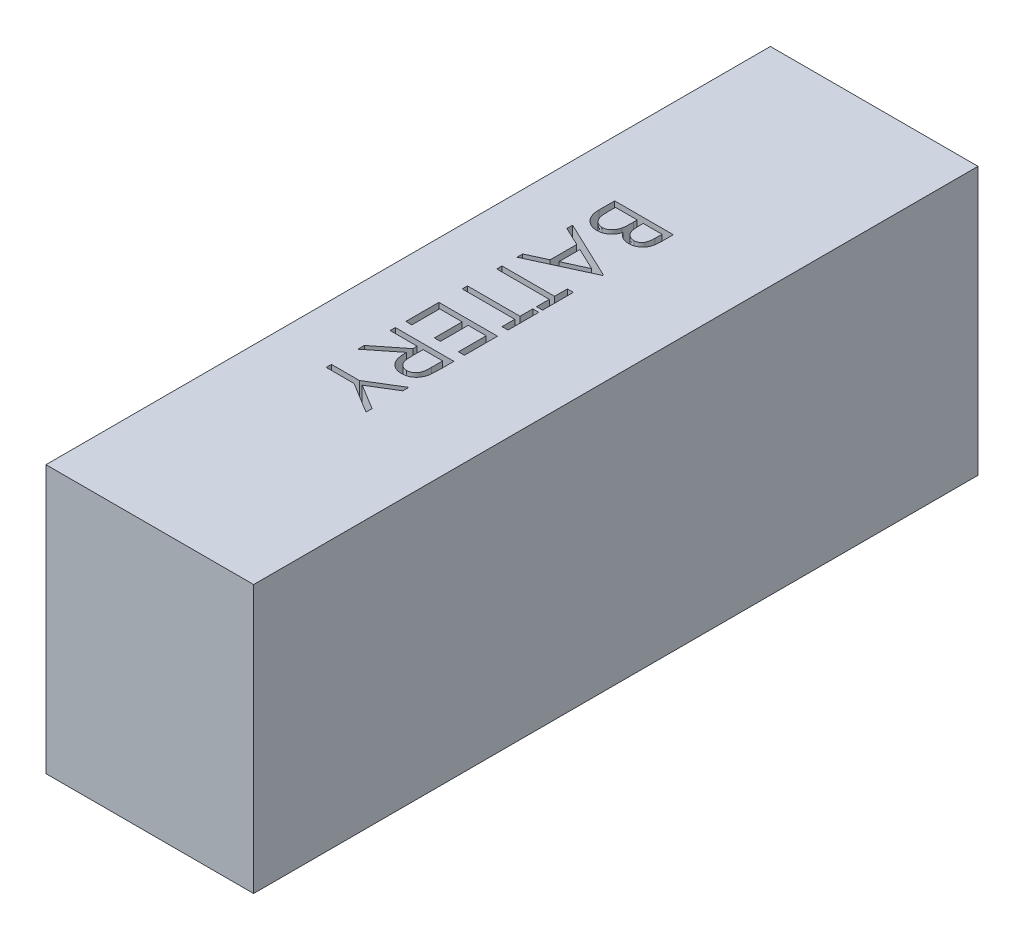
from build123d import *

# Parameters (mm, degrees)
SKETCH1_W           = 45
SKETCH1_H           = 58
BOSS_EXTRUDE1_DEPTH = 157
CUT_EXTRUDE1_DEPTH  = 10


with BuildPart() as part:
    # Sketch1 → Boss-Extrude1 (new body)
    with BuildSketch(Plane.XY):
        with Locations((22.5, 29)):
            Rectangle(SKETCH1_W, SKETCH1_H)
    extrude(amount=-BOSS_EXTRUDE1_DEPTH)

    # Sketch2 → Cut-Extrude1 (cut)
    # profile 1 of 7: a face of its own
    with BuildSketch(Plane(origin=(0, 58, 0), x_dir=(1, 0, 0), z_dir=(0, 1, 0))):
        with BuildLine():
            Line((24.809530829, 111.145512821), (24.809530829, 108.667588141))
            add(Edge.make_bspline(
                [(24.809530829, 108.667588141), (24.808893106, 108.54629052), (24.807657041, 108.311185543), (24.788486822, 107.969303568), (24.762347791, 107.649086455), (24.720872884, 107.350441338), (24.670828435, 107.073506218), (24.610224702, 106.817446506), (24.537556704, 106.583076452), (24.422000198, 106.30326738), (24.250284701, 105.984240982), (23.996543908, 105.638806814), (23.686183256, 105.343425717), (23.336089049, 105.088749652), (22.95096782, 104.886271304), (22.539998764, 104.739788425), (22.108482729, 104.647049848), (21.812234626, 104.637512387), (21.662515605, 104.632692308)],
                knots=[0, 0, 0, 0, 1.001505555, 1.941167018, 2.826882275, 3.653841531, 4.429895133, 5.150066043, 5.825578002, 6.45369114, 7.647487171, 8.808567382, 9.977351308, 11.170798116, 12.373658725, 13.556498008, 14.765093433, 16, 16, 16, 16], degree=3))
            add(Edge.make_bspline(
                [(21.662515605, 104.632692308), (21.522238282, 104.636582462), (21.246580113, 104.644226982), (20.844049009, 104.71981612), (20.459295066, 104.832357565), (20.097061504, 104.99573449), (19.76200381, 105.205887774), (19.456113217, 105.458782995), (19.186802729, 105.759887816), (19.036871162, 105.985844988), (18.96071272, 106.100620994)],
                knots=[0, 0, 0, 0, 1.044266239, 2.052081639, 3.041743201, 4.026043445, 5.00270663, 5.980942822, 6.97441044, 8, 8, 8, 8], degree=3))
            add(Edge.make_bspline(
                [(18.96071272, 106.100620994), (18.905365325, 105.95632328), (18.799472049, 105.680246008), (18.611235299, 105.300054037), (18.408807209, 104.971179544), (18.186575557, 104.693260537), (17.944037947, 104.459156781), (17.686051059, 104.24892675), (17.399913839, 104.072801118), (17.093773846, 103.921494355), (16.76977972, 103.802417518), (16.429413214, 103.718162843), (16.076480239, 103.666392446), (15.835920554, 103.659333035), (15.714478746, 103.655769231)],
                knots=[0, 0, 0, 0, 1.272302504, 2.434229863, 3.488457646, 4.447234501, 5.35599188, 6.26022912, 7.18267843, 8.11661068, 9.06895546, 10.019249207, 11.000057067, 12, 12, 12, 12], degree=3))
            add(Edge.make_bspline(
                [(15.714478746, 103.655769231), (15.590502513, 103.659314899), (15.346575801, 103.6662911), (14.988225701, 103.717728252), (14.645816367, 103.804905405), (14.316913221, 103.924691577), (14.003377969, 104.081915883), (13.701283845, 104.269129061), (13.418678433, 104.496991224), (13.148841064, 104.75097586), (12.906367685, 105.038640782), (12.690499049, 105.348963686), (12.512154803, 105.686408036), (12.364213893, 106.045740962), (12.249560444, 106.429350245), (12.169962703, 106.835813552), (12.116204764, 107.265219212), (12.111793222, 107.559896716), (12.109530829, 107.711017628)],
                knots=[0, 0, 0, 0, 0.978404568, 1.925038397, 2.85041836, 3.763147166, 4.682162379, 5.614488577, 6.562659439, 7.54271123, 8.535210642, 9.526693784, 10.520907202, 11.541451354, 12.589717429, 13.675358278, 14.807842563, 16, 16, 16, 16], degree=3))
            Line((12.109530829, 107.711017628), (12.109530829, 111.145512821))
            Line((12.109530829, 111.145512821), (24.809530829, 111.145512821))
        make_face()
        with BuildLine():
            Line((23.506966727, 110.005769231), (19.436453906, 110.005769231))
            Line((19.436453906, 110.005769231), (19.436453906, 109.240004006))
            add(Edge.make_bspline(
                [(19.436453906, 109.240004006), (19.437892979, 109.128065941), (19.440673562, 108.911778787), (19.448889658, 108.597728502), (19.470887646, 108.306944517), (19.494154147, 108.038424842), (19.529979798, 107.793969213), (19.57382033, 107.57275926), (19.619780365, 107.372807823), (19.698161874, 107.14232471), (19.812827018, 106.880959914), (19.994962363, 106.604106035), (20.206005833, 106.356074076), (20.454013483, 106.148970517), (20.724782893, 105.97807388), (21.018338202, 105.864024881), (21.323219108, 105.783131424), (21.533071985, 105.776037594), (21.63961897, 105.772435897)],
                knots=[0, 0, 0, 0, 1.156481963, 2.23455883, 3.244418989, 4.168404366, 5.01828131, 5.794834307, 6.498111525, 7.13526334, 8.307595709, 9.435046769, 10.546766856, 11.659452936, 12.760769924, 13.837671619, 14.902137667, 16, 16, 16, 16], degree=3))
            add(Edge.make_bspline(
                [(21.63961897, 105.772435897), (21.710139968, 105.774237257), (21.848474607, 105.777770821), (22.049357882, 105.809930451), (22.240706288, 105.856594388), (22.418118944, 105.929497694), (22.586638424, 106.017652859), (22.738779651, 106.132326731), (22.882877828, 106.261832414), (23.013642027, 106.413924233), (23.130807261, 106.58786575), (23.23390239, 106.785314309), (23.315226777, 107.008627547), (23.38817908, 107.252742089), (23.438800029, 107.521564771), (23.481125883, 107.812468828), (23.502641286, 108.127922089), (23.505492754, 108.346162254), (23.506966727, 108.458974359)],
                knots=[0, 0, 0, 0, 0.911752476, 1.788502045, 2.626783689, 3.45400582, 4.26402138, 5.080402872, 5.911472738, 6.767166405, 7.66795952, 8.620018292, 9.640966946, 10.73819047, 11.913090943, 13.176185384, 14.540321519, 16, 16, 16, 16], degree=3))
            Line((23.506966727, 108.458974359), (23.506966727, 110.005769231))
        make_face(mode=Mode.SUBTRACT)
        with BuildLine():
            Line((18.133889803, 110.005769231), (13.412094932, 110.005769231))
            Line((13.412094932, 110.005769231), (13.412094932, 108.382652244))
            add(Edge.make_bspline(
                [(13.412094932, 108.382652244), (13.413482523, 108.266468708), (13.416156923, 108.042540259), (13.424983038, 107.719237749), (13.444637484, 107.420394528), (13.476679472, 107.145838632), (13.509973891, 106.893153221), (13.556054976, 106.664848731), (13.608443598, 106.460575153), (13.689517472, 106.223744861), (13.815252181, 105.956887506), (14.006068063, 105.669509001), (14.230402386, 105.411454901), (14.493313949, 105.194831409), (14.777020994, 105.015952223), (15.080039637, 104.890493813), (15.393125684, 104.809825853), (15.60714542, 104.800293436), (15.714478746, 104.795512821)],
                knots=[0, 0, 0, 0, 1.159821618, 2.235403267, 3.228114831, 4.14795534, 4.994323282, 5.771256229, 6.471395042, 7.097801288, 8.267864287, 9.404187171, 10.531774336, 11.667624178, 12.792825787, 13.866573821, 14.930062559, 16, 16, 16, 16], degree=3))
            add(Edge.make_bspline(
                [(15.714478746, 104.795512821), (15.781591834, 104.796489963), (15.914735472, 104.798428488), (16.110246303, 104.828763131), (16.300476302, 104.871081938), (16.482548915, 104.932363208), (16.659426851, 105.009633923), (16.828029175, 105.106605738), (16.99238723, 105.218589814), (17.199934206, 105.39376991), (17.439144968, 105.648331942), (17.673315153, 106.010145839), (17.86217681, 106.421519463), (17.942365987, 106.719888629), (17.983789643, 106.874018429)],
                knots=[0, 0, 0, 0, 0.723503378, 1.435336582, 2.130201219, 2.824764462, 3.504949994, 4.209866579, 4.920640069, 5.648298893, 7.13757748, 8.670694625, 10.280166878, 12, 12, 12, 12], degree=3))
            add(Edge.make_bspline(
                [(17.983789643, 106.874018429), (17.996327505, 106.935809662), (18.023512175, 107.069785801), (18.052189636, 107.288254417), (18.077914253, 107.538503756), (18.096443163, 107.819464208), (18.116333625, 108.132253189), (18.123793762, 108.476770213), (18.132899252, 108.853258839), (18.133551173, 109.114488624), (18.133889803, 109.250180288)],
                knots=[0, 0, 0, 0, 0.634452549, 1.375623993, 2.216454381, 3.166361212, 4.209414599, 5.370755378, 6.634280627, 8, 8, 8, 8], degree=3))
            Line((18.133889803, 109.250180288), (18.133889803, 110.005769231))
        make_face(mode=Mode.SUBTRACT)
    # profile 2 of 7: a face of its own
    with BuildSketch(Plane(origin=(0, 58, 0), x_dir=(1, 0, 0), z_dir=(0, 1, 0))):
        Polygon((24.809530829, 95.840384615), (12.109530829, 89.978846154), (12.109530829, 91.217808494), (16.18004365, 93.095332532), (16.18004365, 98.852564103), (12.109530829, 100.783513622), (12.109530829, 102.027564103), (24.809530829, 96.003205128), align=None)
        Polygon((22.33415022, 95.934515224), (17.482607752, 98.234354968), (17.482607752, 93.695733173), align=None, mode=Mode.SUBTRACT)
    # profile 3 of 7: a face of its own
    with BuildSketch(Plane(origin=(0, 58, 0), x_dir=(1, 0, 0), z_dir=(0, 1, 0))):
        Polygon((23.506966727, 89.490384615), (24.809530829, 89.490384615), (24.809530829, 82.81474359), (23.506966727, 82.81474359), (23.506966727, 85.582692308), (12.109530829, 85.582692308), (12.109530829, 86.722435897), (23.506966727, 86.722435897), align=None)
    # profile 4 of 7: a face of its own
    with BuildSketch(Plane(origin=(0, 58, 0), x_dir=(1, 0, 0), z_dir=(0, 1, 0))):
        Polygon((23.506966727, 82.000641026), (24.809530829, 82.000641026), (24.809530829, 75.325), (23.506966727, 75.325), (23.506966727, 78.092948718), (12.109530829, 78.092948718), (12.109530829, 79.232692308), (23.506966727, 79.232692308), align=None)
    # profile 5 of 7: a face of its own
    with BuildSketch(Plane(origin=(0, 58, 0), x_dir=(1, 0, 0), z_dir=(0, 1, 0))):
        Polygon((24.809530829, 73.045512821), (24.809530829, 65.881410256), (23.506966727, 65.881410256), (23.506966727, 71.905769231), (19.599274419, 71.905769231), (19.599274419, 65.881410256), (18.296710316, 65.881410256), (18.296710316, 71.905769231), (13.412094932, 71.905769231), (13.412094932, 65.881410256), (12.109530829, 65.881410256), (12.109530829, 73.045512821), align=None)
    # profile 6 of 7: a face of its own
    with BuildSketch(Plane(origin=(0, 58, 0), x_dir=(1, 0, 0), z_dir=(0, 1, 0))):
        with BuildLine():
            Line((24.809530829, 63.601923077), (24.809530829, 61.060396635))
            add(Edge.make_bspline(
                [(24.809530829, 61.060396635), (24.808966274, 60.890793111), (24.807882266, 60.565135559), (24.801837927, 60.098598263), (24.784513836, 59.674682797), (24.769605547, 59.293610809), (24.742420503, 58.955389289), (24.716437584, 58.65898112), (24.682424586, 58.405751475), (24.650836337, 58.252459386), (24.636534034, 58.183052885)],
                knots=[0, 0, 0, 0, 1.410062039, 2.707475311, 3.878576406, 4.937260626, 5.877586885, 6.699081471, 7.410979367, 8, 8, 8, 8], degree=3))
            add(Edge.make_bspline(
                [(24.636534034, 58.183052885), (24.613579519, 58.090135783), (24.568160169, 57.906283755), (24.472111835, 57.641602973), (24.361145734, 57.389277684), (24.229800309, 57.150254792), (24.080366507, 56.924512121), (23.91197124, 56.712387672), (23.723756935, 56.515094219), (23.520529794, 56.331113686), (23.300516599, 56.164341253), (23.066922345, 56.020021533), (22.821208028, 55.896441282), (22.56251798, 55.79778345), (22.293038999, 55.71841625), (22.010418028, 55.662435913), (21.715918501, 55.628868735), (21.515048531, 55.625450949), (21.413196694, 55.623717949)],
                knots=[0, 0, 0, 0, 1.02737288, 2.032829108, 3.019628684, 3.985738875, 4.958353778, 5.924249254, 6.890702889, 7.883913451, 8.865824512, 9.85161466, 10.829249435, 11.81541824, 12.821369441, 13.843154991, 14.906364023, 16, 16, 16, 16], degree=3))
            add(Edge.make_bspline(
                [(21.413196694, 55.623717949), (21.243977692, 55.629048175), (20.913787588, 55.639448827), (20.434597967, 55.736424707), (19.987586793, 55.895263869), (19.573376151, 56.114177265), (19.199821907, 56.392825875), (18.872826763, 56.72769814), (18.596664465, 57.117083891), (18.407192789, 57.481278361), (18.285278592, 57.803141297), (18.199068697, 58.068896671), (18.133583953, 58.359010986), (18.07406747, 58.669322112), (18.028651613, 59.002226923), (17.996397722, 59.357055031), (17.975658225, 59.734693881), (17.972628096, 59.993555302), (17.971069291, 60.126722756)],
                knots=[0, 0, 0, 0, 1.260402266, 2.459371274, 3.627181936, 4.786749125, 5.93865593, 7.087644312, 8.261344208, 9.485713728, 10.136162886, 10.825977872, 11.566646758, 12.35154167, 13.181268117, 14.0701832, 15.007234106, 16, 16, 16, 16], degree=3))
            Line((17.971069291, 60.126722756), (12.109530829, 55.460897436))
            Line((12.109530829, 55.460897436), (12.109530829, 56.8703125))
            Line((12.109530829, 56.8703125), (17.971069291, 61.536137821))
            Line((17.971069291, 61.536137821), (17.971069291, 62.462179487))
            Line((17.971069291, 62.462179487), (12.109530829, 62.462179487))
            Line((12.109530829, 62.462179487), (12.109530829, 63.601923077))
            Line((12.109530829, 63.601923077), (24.809530829, 63.601923077))
        make_face()
        with BuildLine():
            Line((23.506966727, 62.462179487), (19.273633393, 62.462179487))
            Line((19.273633393, 62.462179487), (19.2558249, 60.136899038))
            add(Edge.make_bspline(
                [(19.2558249, 60.136899038), (19.25577687, 60.028332041), (19.255683774, 59.817898277), (19.270175472, 59.513458716), (19.286661243, 59.229994331), (19.311877386, 58.968589247), (19.344375307, 58.729127073), (19.385025564, 58.51172623), (19.432387769, 58.316035979), (19.505682963, 58.087793932), (19.621872139, 57.833004661), (19.790630296, 57.555759876), (20.004264707, 57.320464533), (20.244669776, 57.117594342), (20.514426437, 56.961332626), (20.801561208, 56.847601512), (21.103595161, 56.7762289), (21.31104728, 56.767743705), (21.415740765, 56.763461538)],
                knots=[0, 0, 0, 0, 1.14660753, 2.222451964, 3.218720504, 4.145691244, 4.995719623, 5.770487122, 6.480909919, 7.121111896, 8.299844659, 9.430703709, 10.534634535, 11.641396424, 12.741395289, 13.810956493, 14.895269934, 16, 16, 16, 16], degree=3))
            add(Edge.make_bspline(
                [(21.415740765, 56.763461538), (21.517900941, 56.767756868), (21.720345132, 56.776268645), (22.015904744, 56.847739799), (22.296853642, 56.963155263), (22.557836751, 57.124994454), (22.796712836, 57.320552295), (22.998276049, 57.55280631), (23.167073493, 57.810059901), (23.274153156, 58.050671279), (23.339933894, 58.265584874), (23.386166118, 58.452209946), (23.423623311, 58.663881826), (23.452745571, 58.900093232), (23.478952278, 59.160416819), (23.495944012, 59.445565404), (23.506213819, 59.755209702), (23.506709917, 59.969829478), (23.506966727, 60.080929487)],
                knots=[0, 0, 0, 0, 1.100801541, 2.181386982, 3.260112282, 4.364594493, 5.481957178, 6.577424609, 7.668452592, 8.790448866, 9.403819393, 10.091598921, 10.863153553, 11.720938239, 12.658472417, 13.685008818, 14.801622349, 16, 16, 16, 16], degree=3))
            Line((23.506966727, 60.080929487), (23.506966727, 62.462179487))
        make_face(mode=Mode.SUBTRACT)
    # profile 7 of 7: a face of its own
    with BuildSketch(Plane(origin=(0, 58, 0), x_dir=(1, 0, 0), z_dir=(0, 1, 0))):
        Polygon((24.809530829, 53.832692308), (24.809530829, 52.527584135), (19.352499579, 49.189763622), (24.809530829, 45.85703125), (24.809530829, 44.551923077), (18.146610156, 48.622435897), (12.109530829, 48.622435897), (12.109530829, 49.762179487), (18.146610156, 49.762179487), align=None)
    extrude(amount=-CUT_EXTRUDE1_DEPTH, mode=Mode.SUBTRACT)


solid = part.part
